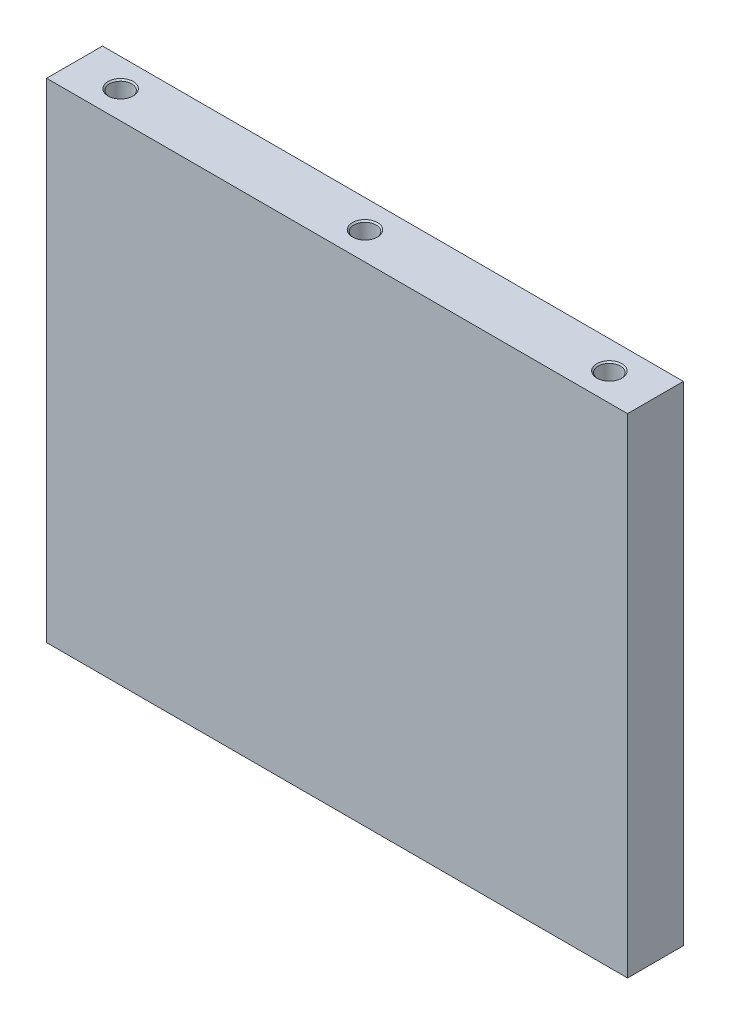
from build123d import *

# Parameters (mm, degrees)
SKETCH1_W           = 208
SKETCH1_H           = 20
BOSS_EXTRUDE1_DEPTH = 175
SKETCH2_R           = 4
CUT_EXTRUDE1_DEPTH  = 12
SKETCH3_R           = 4
CUT_EXTRUDE2_DEPTH  = 15
CHAMFER1_SIZE       = 0.5


with BuildPart() as part:
    # Sketch1 → Boss-Extrude1 (new body)
    with BuildSketch(Plane(origin=(0, 0, -58), x_dir=(1, 0, 0), z_dir=(0, 1, 0))):
        with Locations((0, -58)):
            Rectangle(SKETCH1_W, SKETCH1_H)
    extrude(amount=BOSS_EXTRUDE1_DEPTH)

    # Sketch2 → Cut-Extrude1 (cut)
    with BuildSketch(Plane(origin=(0, 175, 0), x_dir=(1, 0, 0), z_dir=(0, 1, 0))):
        with Locations(Location((0, 0, 0), (0, 0, 270))):
            Circle(SKETCH2_R)
        with Locations(Location((-87.5, 0, 0), (0, 0, 270))):
            Circle(SKETCH2_R)
        with Locations(Location((87.5, 0, 0), (0, 0, 90))):
            Circle(SKETCH2_R)
    extrude(amount=-CUT_EXTRUDE1_DEPTH, mode=Mode.SUBTRACT)

    # Sketch3 → Cut-Extrude2 (cut)
    with BuildSketch(Plane.XZ):
        with Locations(Location((-55, 0, 0), (0, 0, 270))):
            Circle(SKETCH3_R)
        with Locations(Location((55, 0, 0), (0, 0, 90))):
            Circle(SKETCH3_R)
    extrude(amount=-CUT_EXTRUDE2_DEPTH, mode=Mode.SUBTRACT)

    # Chamfer1
    chamfer1_edges = [part.edges().sort_by_distance(p)[0] for p in [
        (87.5, 175, 4),
        (-87.5, 175, -4),
        (0, 175, -4),
        (-55, 0, 4),
        (55, 0, -4),
    ]]
    chamfer(chamfer1_edges, length=CHAMFER1_SIZE)


solid = part.part
